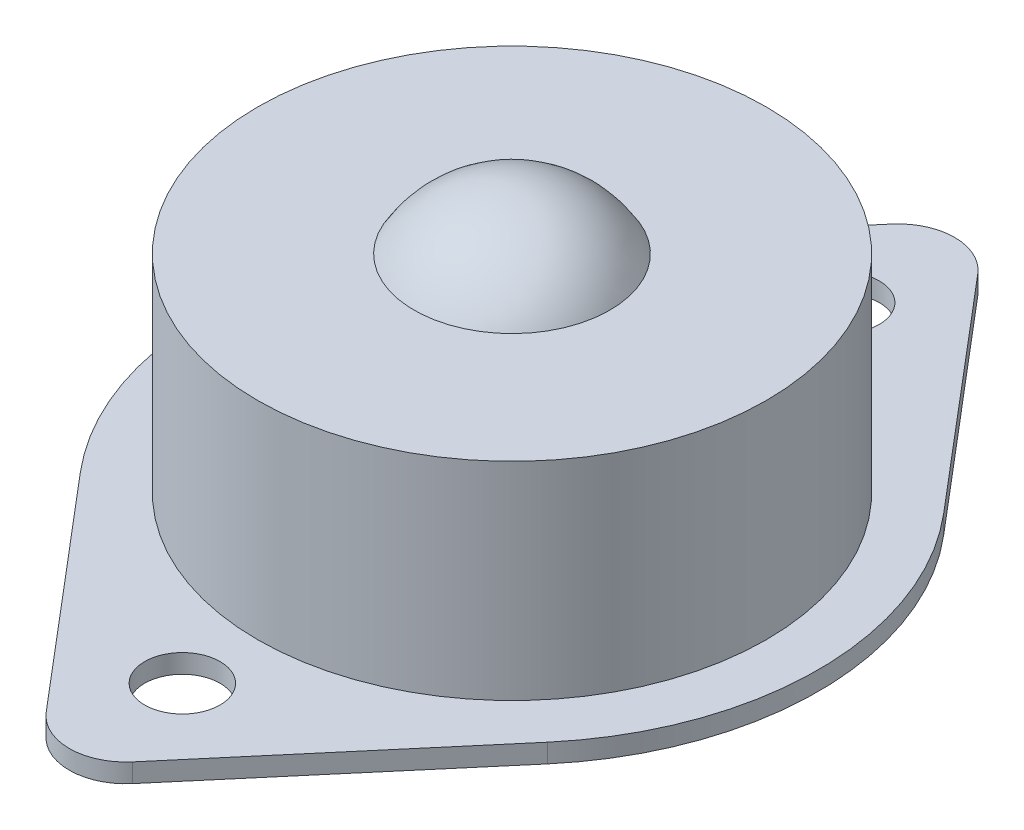
from build123d import *

# Parameters (mm, degrees)
SKETCH_3_R          = 2
CUT_EXTRUDE_4_DEPTH = 1
SKETCH_5_R          = 33.306153754
CUT_EXTRUDE_5_DEPTH = 1


with BuildPart() as part:
    # 草图1 → 旋转2 (revolve)
    with BuildSketch(Plane(origin=(0, 0, 0), x_dir=(0, 0, -1), z_dir=(1, 0, 0)), mode=Mode.PRIVATE) as revolve_2_sk:
        with BuildLine():
            Line((0, 0), (-23.5, 0))
            Line((-23.5, 0), (-23.5, 1))
            Line((-23.5, 1), (-13.5, 1))
            Line((-13.5, 1), (-13.5, 12))
            Line((-13.5, 12), (-5.196152423, 12))
            ThreePointArc((-5.196152423, 12), (-3, 14.196152423), (0, 15))
            Line((0, 15), (0, 9))
            Line((0, 9), (0, 0))
        make_face()
    revolve(revolve_2_sk.sketch.rotate(Axis((0, 0, 0), (0, 1, 0)), 180), axis=Axis((0, 0, 0), (0, 1, 0)))

    # 草图3 → 切除-拉伸4 (cut)
    with BuildSketch(Plane(origin=(0, 0, 0), x_dir=(1, 0, 0), z_dir=(0, 1, 0))):
        with Locations(Location((0, 17.5, 0), (0, 0, 90))):
            Circle(SKETCH_3_R)
        with Locations(Location((0, -17.5, 0), (0, 0, 90))):
            Circle(SKETCH_3_R)
    extrude(amount=CUT_EXTRUDE_4_DEPTH, mode=Mode.SUBTRACT)

    # 草图5 → 切除-拉伸5 (cut)
    with BuildSketch(Plane(origin=(0, 0, 0), x_dir=(1, 0, 0), z_dir=(0, 1, 0))):
        Circle(SKETCH_5_R)
        with BuildLine():
            Line((2.288026903, -22.440343498), (12.400353743, -10.516023969))
            ThreePointArc((12.400353743, -10.516023969), (16.259013902, 0), (12.400353743, 10.516023969))
            Line((12.400353743, 10.516023969), (2.288026903, 22.440343498))
            ThreePointArc((2.288026903, 22.440343498), (0, 23.5), (-2.288026903, 22.440343498))
            Line((-2.288026903, 22.440343498), (-12.400353743, 10.516023969))
            ThreePointArc((-12.400353743, 10.516023969), (-16.259013902, 0), (-12.400353743, -10.516023969))
            Line((-12.400353743, -10.516023969), (-2.288026903, -22.440343498))
            ThreePointArc((-2.288026903, -22.440343498), (0, -23.5), (2.288026903, -22.440343498))
        make_face(mode=Mode.SUBTRACT)
    extrude(amount=CUT_EXTRUDE_5_DEPTH, mode=Mode.SUBTRACT)


solid = part.part
